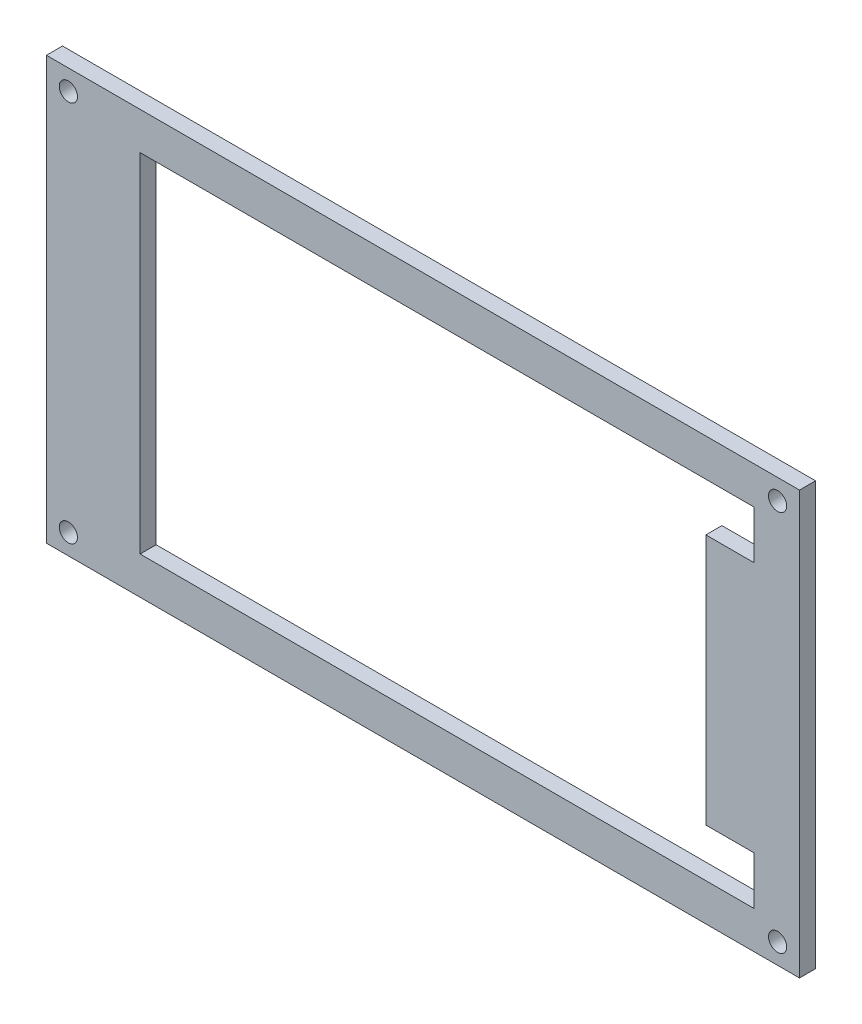
from build123d import *

# Parameters (mm, degrees)
SKETCH_1_W          = 140.7
SKETCH_1_H          = 78.95
SKETCH_1_R          = 1.7
EXTRUDE_1_DEPTH     = 3
SKETCH_2_W          = 105.7
SKETCH_2_H          = 64.95
CUT_EXTRUDE_1_DEPTH = 81.724210278
SKETCH_3_W          = 9
SKETCH_3_H          = 9
CUT_EXTRUDE_2_DEPTH = 81.724210278


with BuildPart() as part:
    # 草图1 → 凸台-拉伸1 (new body)
    with BuildSketch(Plane.XY):
        Rectangle(SKETCH_1_W, SKETCH_1_H)
        with Locations((-66.25272379, 35.66826865)):
            Circle(SKETCH_1_R, mode=Mode.SUBTRACT)
        with Locations(Location((66.25272379, 35.66826865, 0), (0, 0, 180))):
            Circle(SKETCH_1_R, mode=Mode.SUBTRACT)
        with Locations((66.25272379, -35.66826865)):
            Circle(SKETCH_1_R, mode=Mode.SUBTRACT)
        with Locations(Location((-66.25272379, -35.66826865, 0), (0, 0, 180))):
            Circle(SKETCH_1_R, mode=Mode.SUBTRACT)
    extrude(amount=EXTRUDE_1_DEPTH)

    # 草图2 → 切除-拉伸1 (cut, through all)
    with BuildSketch(Plane.XY.offset(3)):
        Rectangle(SKETCH_2_W, SKETCH_2_H)
    extrude(amount=-CUT_EXTRUDE_1_DEPTH, mode=Mode.SUBTRACT)

    # 草图3 → 切除-拉伸2 (cut, through all)
    with BuildSketch(Plane.XY.offset(3)):
        with Locations((57.35, 27.975)):
            Rectangle(SKETCH_3_W, SKETCH_3_H)
        with Locations((57.35, -27.975)):
            Rectangle(SKETCH_3_W, SKETCH_3_H)
    extrude(amount=-CUT_EXTRUDE_2_DEPTH, mode=Mode.SUBTRACT)


solid = part.part
